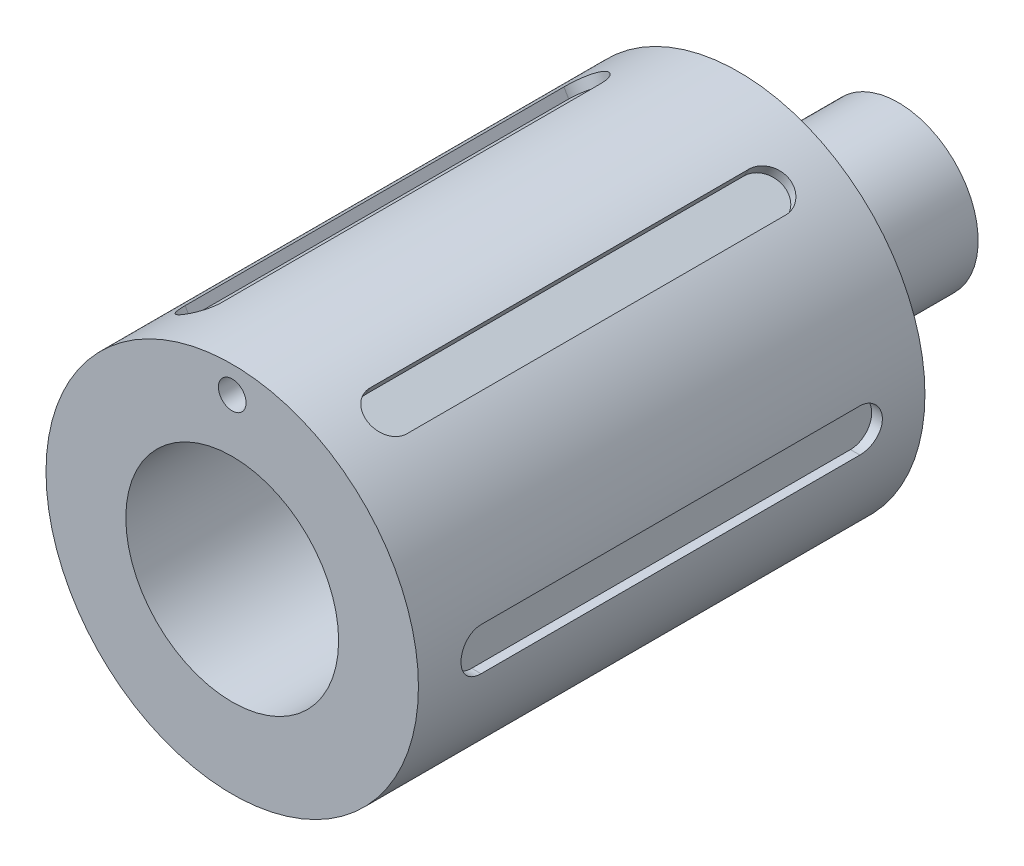
from build123d import *

# Parameters (mm, degrees)
F_3_8_0_13_DIAMETER_HOLE1_D     = 3.302
F_3_8_0_13_DIAMETER_HOLE1_DEPTH = 15.875
F_3_8_0_13_DIAMETER_HOLE1_TIP   = 0.992020882
CUT_EXTRUDE1_DEPTH              = 1.27
CIRPATTERN1_COUNT               = 6


with BuildPart() as part:
    # Sketch1 → Revolve1 (revolve)
    with BuildSketch(Plane(origin=(0, 0, 0), x_dir=(0, 0, -1), z_dir=(1, 0, 0)), mode=Mode.PRIVATE) as revolve1_sk:
        Polygon((0, 0), (57.15, 0), (57.15, 12.7), (79.502, 12.7), (79.502, 3.175), (60.452, 3.175), (60.452, -9.525), (0, -9.525), align=None)
    revolve(revolve1_sk.sketch.rotate(Axis((0, 12.7, -79.502), (0, 0, 1)), 270), axis=Axis((0, 12.7, -79.502), (0, 0, 1)))

    # 3/8 (0.13) Diameter Hole1
    with Locations(Plane.XY):
        with Locations((0, 31.75)):
            Hole(F_3_8_0_13_DIAMETER_HOLE1_D / 2, depth=F_3_8_0_13_DIAMETER_HOLE1_DEPTH)
            with Locations((0, 0, -(F_3_8_0_13_DIAMETER_HOLE1_DEPTH + F_3_8_0_13_DIAMETER_HOLE1_TIP / 2))):  # 118° drill point
                Cone(0, F_3_8_0_13_DIAMETER_HOLE1_D / 2, F_3_8_0_13_DIAMETER_HOLE1_TIP, mode=Mode.SUBTRACT)

    # Sketch5 → Cut-Extrude1 (cut)
    with BuildSketch(Plane(origin=(22.225, 0, 0), x_dir=(0, 0, -1), z_dir=(1, 0, 0))):
        with BuildLine():
            Line((7.62, 15.24), (52.832, 15.24))
            ThreePointArc((52.832, 15.24), (55.372, 12.7), (52.832, 10.16))
            Line((52.832, 10.16), (7.62, 10.16))
            ThreePointArc((7.62, 10.16), (5.08, 12.7), (7.62, 15.24))
        make_face()
    cut_extrude1 = extrude(amount=-CUT_EXTRUDE1_DEPTH, mode=Mode.SUBTRACT)

    # CirPattern1: Cut-Extrude1 ×6 about axis
    cirpattern1_axis = Axis((0, 12.7, 0), (0, 0, 1))
    for i in range(1, CIRPATTERN1_COUNT):
        add(cut_extrude1.rotate(cirpattern1_axis, i * 360 / CIRPATTERN1_COUNT), mode=Mode.SUBTRACT)


solid = part.part
